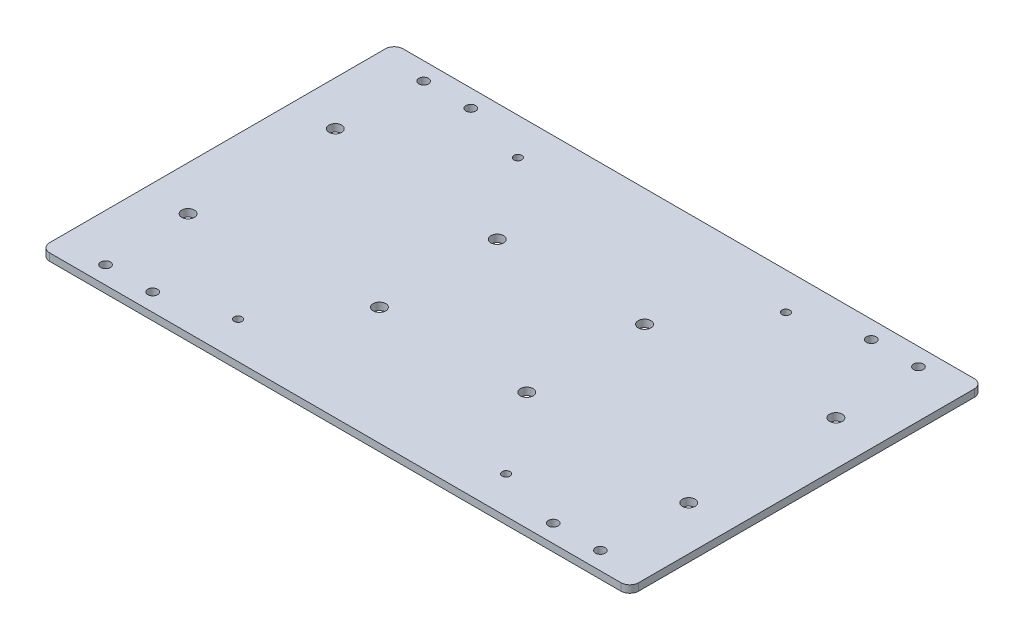
from build123d import *

# Parameters (mm, degrees)
SKETCH_1_W          = 200
SKETCH_1_H          = 120
SKETCH_1_R          = 1.65
SKETCH_1_R_2        = 2.15
EXTRUDE_2_DEPTH     = 2.5
CUT_EXTRUDE_1_REACH = 118.646
SKETCH_2_R          = 1.35
FILLET_1_R          = 3


with BuildPart() as part:
    # 草圖1 → 填料-伸長2 (new body)
    with BuildSketch(Plane(origin=(0, 0, 0), x_dir=(1, 0, 0), z_dir=(0, 1, 0))):
        Rectangle(SKETCH_1_W, SKETCH_1_H)
        with Locations(Location((-84, 54, 0), (0, 0, 270))):
            Circle(SKETCH_1_R, mode=Mode.SUBTRACT)
        with Locations(Location((-68, 54, 0), (0, 0, 270))):
            Circle(SKETCH_1_R, mode=Mode.SUBTRACT)
        with Locations(Location((68, 54, 0), (0, 0, 270))):
            Circle(SKETCH_1_R, mode=Mode.SUBTRACT)
        with Locations(Location((84, 54, 0), (0, 0, 270))):
            Circle(SKETCH_1_R, mode=Mode.SUBTRACT)
        with Locations(Location((84, -54, 0), (0, 0, 90))):
            Circle(SKETCH_1_R, mode=Mode.SUBTRACT)
        with Locations(Location((68, -54, 0), (0, 0, 90))):
            Circle(SKETCH_1_R, mode=Mode.SUBTRACT)
        with Locations(Location((-68, -54, 0), (0, 0, 90))):
            Circle(SKETCH_1_R, mode=Mode.SUBTRACT)
        with Locations(Location((-84, -54, 0), (0, 0, 90))):
            Circle(SKETCH_1_R, mode=Mode.SUBTRACT)
        with Locations(Location((25, 20, 0), (0, 0, 270))):
            Circle(SKETCH_1_R_2, mode=Mode.SUBTRACT)
        with Locations(Location((-25, 20, 0), (0, 0, 270))):
            Circle(SKETCH_1_R_2, mode=Mode.SUBTRACT)
        with Locations(Location((-25, -20, 0), (0, 0, 270))):
            Circle(SKETCH_1_R_2, mode=Mode.SUBTRACT)
        with Locations(Location((25, -20, 0), (0, 0, 270))):
            Circle(SKETCH_1_R_2, mode=Mode.SUBTRACT)
        with Locations(Location((85, 25, 0), (0, 0, 270))):
            Circle(SKETCH_1_R_2, mode=Mode.SUBTRACT)
        with Locations(Location((85, -25, 0), (0, 0, 270))):
            Circle(SKETCH_1_R_2, mode=Mode.SUBTRACT)
        with Locations(Location((-85, -25, 0), (0, 0, 90))):
            Circle(SKETCH_1_R_2, mode=Mode.SUBTRACT)
        with Locations(Location((-85, 25, 0), (0, 0, 90))):
            Circle(SKETCH_1_R_2, mode=Mode.SUBTRACT)
    extrude(amount=EXTRUDE_2_DEPTH)

    # 草圖2 → 除料-伸長1 (cut, up to next)
    with BuildSketch(Plane(origin=(0, 2.5, 0), x_dir=(1, 0, 0), z_dir=(0, 1, 0)), mode=Mode.PRIVATE) as cut_extrude_1_sk1:
        with Locations(Location((-45.5, 47.5, 0), (0, 0, 270))):
            Circle(SKETCH_2_R)
    cut_extrude_1_tool1 = extrude(cut_extrude_1_sk1.sketch, amount=-CUT_EXTRUDE_1_REACH, mode=Mode.PRIVATE) & part.part
    # 草圖2 → 除料-伸長1 (cut, up to next)
    with BuildSketch(Plane(origin=(0, 2.5, 0), x_dir=(1, 0, 0), z_dir=(0, 1, 0)), mode=Mode.PRIVATE) as cut_extrude_1_sk2:
        with Locations(Location((45.5, 47.5, 0), (0, 0, 270))):
            Circle(SKETCH_2_R)
    cut_extrude_1_tool2 = extrude(cut_extrude_1_sk2.sketch, amount=-CUT_EXTRUDE_1_REACH, mode=Mode.PRIVATE) & part.part
    # 草圖2 → 除料-伸長1 (cut, up to next)
    with BuildSketch(Plane(origin=(0, 2.5, 0), x_dir=(1, 0, 0), z_dir=(0, 1, 0)), mode=Mode.PRIVATE) as cut_extrude_1_sk3:
        with Locations(Location((-45.5, -47.5, 0), (0, 0, 270))):
            Circle(SKETCH_2_R)
    cut_extrude_1_tool3 = extrude(cut_extrude_1_sk3.sketch, amount=-CUT_EXTRUDE_1_REACH, mode=Mode.PRIVATE) & part.part
    # 草圖2 → 除料-伸長1 (cut, up to next)
    with BuildSketch(Plane(origin=(0, 2.5, 0), x_dir=(1, 0, 0), z_dir=(0, 1, 0)), mode=Mode.PRIVATE) as cut_extrude_1_sk4:
        with Locations(Location((45.5, -47.5, 0), (0, 0, 270))):
            Circle(SKETCH_2_R)
    cut_extrude_1_tool4 = extrude(cut_extrude_1_sk4.sketch, amount=-CUT_EXTRUDE_1_REACH, mode=Mode.PRIVATE) & part.part
    add(cut_extrude_1_tool1.solids().sort_by_distance((-45.5, 2.5, -47.5))[0], mode=Mode.SUBTRACT)
    add(cut_extrude_1_tool2.solids().sort_by_distance((45.5, 2.5, -47.5))[0], mode=Mode.SUBTRACT)
    add(cut_extrude_1_tool3.solids().sort_by_distance((-45.5, 2.5, 47.5))[0], mode=Mode.SUBTRACT)
    add(cut_extrude_1_tool4.solids().sort_by_distance((45.5, 2.5, 47.5))[0], mode=Mode.SUBTRACT)

    # 圓角1
    fillet_1_edges = [part.edges().sort_by_distance(p)[0] for p in [
        (-100, 1.25, -60),
        (100, 1.25, -60),
        (100, 1.25, 60),
        (-100, 1.25, 60),
    ]]
    fillet(fillet_1_edges, radius=FILLET_1_R)


solid = part.part
